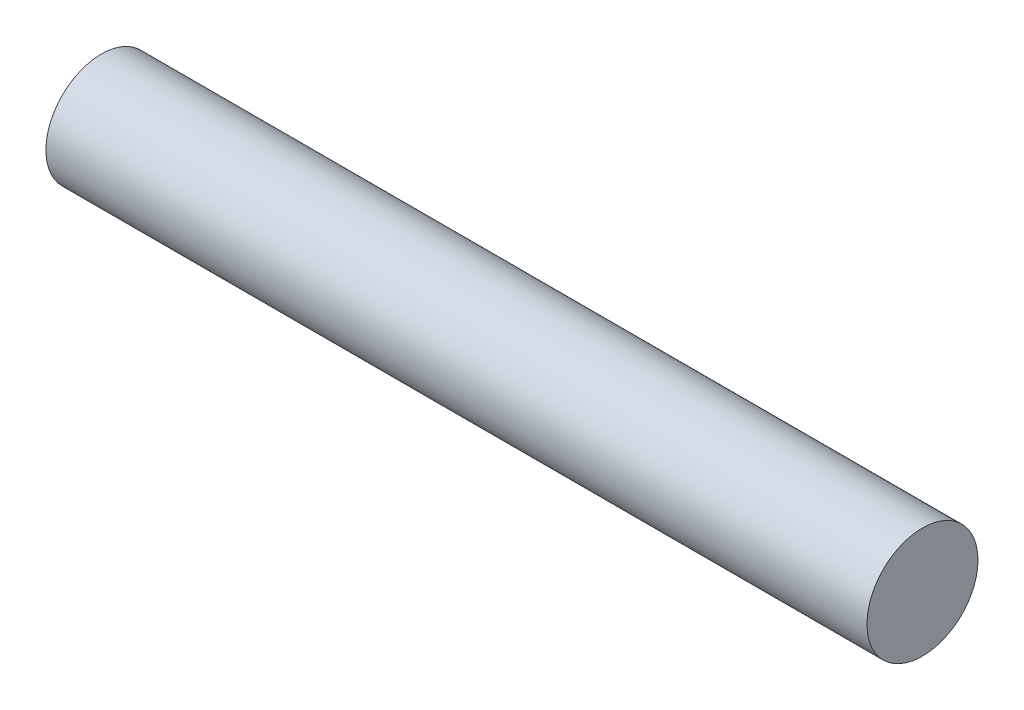
from build123d import *

# Parameters (mm, degrees)
SKETCH1_R           = 3.96875
BOSS_EXTRUDE1_DEPTH = 58.674


with BuildPart() as part:
    # Sketch1 → Boss-Extrude1 (new body)
    with BuildSketch(Plane(origin=(0, 0, 0), x_dir=(0, 0, -1), z_dir=(1, 0, 0))):
        Circle(SKETCH1_R)
    extrude(amount=BOSS_EXTRUDE1_DEPTH)


solid = part.part
